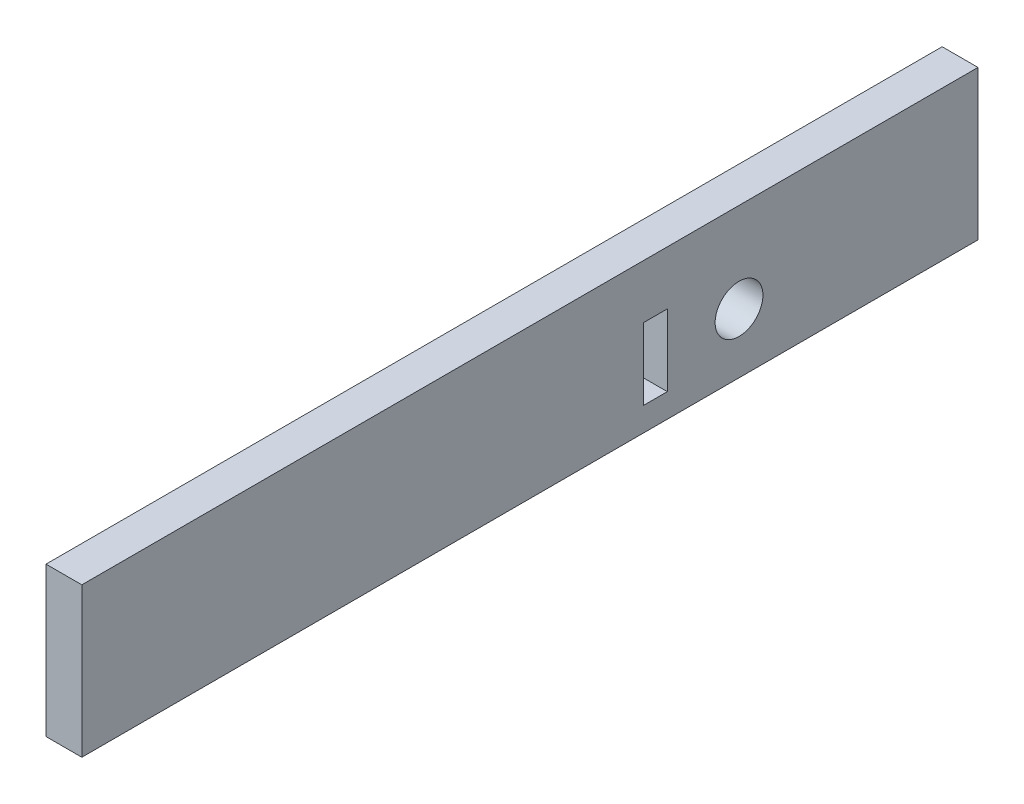
from build123d import *

# Parameters (mm, degrees)
SKETCH1_W           = 150
SKETCH1_H           = 25
SKETCH1_R           = 4
SKETCH1_W_2         = 4
SKETCH1_H_2         = 12
BOSS_EXTRUDE1_DEPTH = 6


with BuildPart() as part:
    # Sketch1 → Boss-Extrude1 (new body)
    with BuildSketch(Plane(origin=(0, 0, 0), x_dir=(0, 0, -1), z_dir=(1, 0, 0))):
        with Locations((75, 12.5)):
            Rectangle(SKETCH1_W, SKETCH1_H)
        with Locations((110, 10)):
            Circle(SKETCH1_R, mode=Mode.SUBTRACT)
        with Locations((96, 10)):
            Rectangle(SKETCH1_W_2, SKETCH1_H_2, mode=Mode.SUBTRACT)
    extrude(amount=BOSS_EXTRUDE1_DEPTH)


solid = part.part
